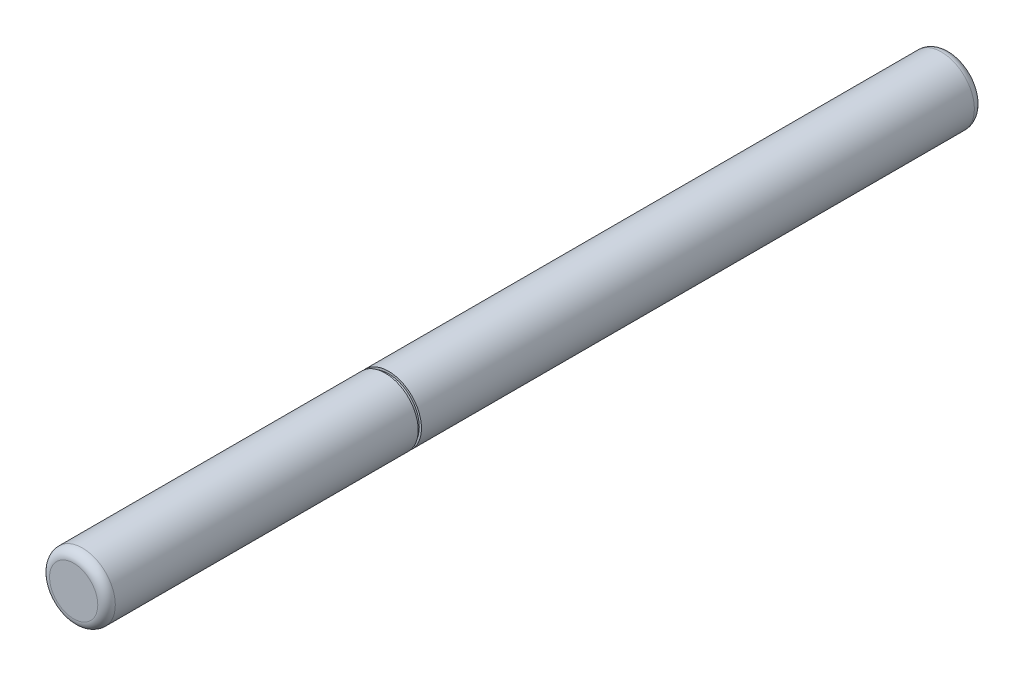
from build123d import *

# Parameters (mm, degrees)
SKETCH1_R           = 1.5
BOSS_EXTRUDE1_DEPTH = 40
FILLET1_R           = 0.4
SKETCH2_R           = 2.972656176
SKETCH2_R_2         = 1.4
CUT_EXTRUDE1_DEPTH  = 0.15


with BuildPart() as part:
    # Sketch1 → Boss-Extrude1 (new body)
    with BuildSketch(Plane.XY):
        Circle(SKETCH1_R)
    extrude(amount=BOSS_EXTRUDE1_DEPTH)

    # Fillet1
    fillet1_edges = [part.edges().sort_by_distance(p)[0] for p in [
        (-1.5, 0, 0),
        (-1.5, 0, 40),
    ]]
    fillet(fillet1_edges, radius=FILLET1_R)

    # Sketch2 → Cut-Extrude1 (cut)
    with BuildSketch(Plane.XY.offset(25.78)):
        Circle(SKETCH2_R)
        Circle(SKETCH2_R_2, mode=Mode.SUBTRACT)
    extrude(amount=-CUT_EXTRUDE1_DEPTH, mode=Mode.SUBTRACT)


solid = part.part
